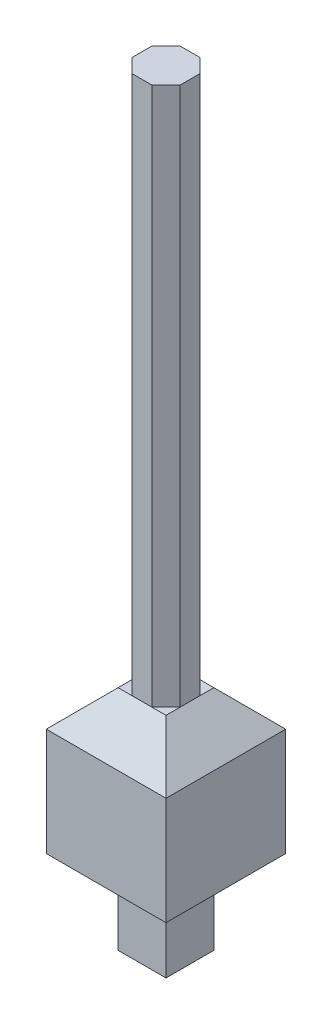
from build123d import *

# Parameters (mm, degrees)
SKETCH5_W            = 10
SKETCH5_H            = 10
BOSS_EXTRUDE6_DEPTH  = 8
CHAMFER10_SIZE       = 3
SKETCH6_W            = 4
SKETCH6_H            = 4
BOSS_EXTRUDE7_DEPTH  = 4
SKETCH7_W            = 10
SKETCH7_H            = 10
BOSS_EXTRUDE9_DEPTH  = 7
CHAMFER13_SIZE       = 3
BOSS_EXTRUDE11_DEPTH = 45


with BuildPart() as part:
    # Sketch5 → Boss-Extrude6 (new body)
    with BuildSketch(Plane(origin=(0, 0, 0), x_dir=(1, 0, 0), z_dir=(0, 1, 0))):
        Rectangle(SKETCH5_W, SKETCH5_H)
    extrude(amount=BOSS_EXTRUDE6_DEPTH)

    # Chamfer10
    chamfer10_edges = [part.edges().sort_by_distance(p)[0] for p in [
        (0, 0, 5),
        (-5, 0, 0),
        (0, 0, -5),
        (5, 0, 0),
    ]]
    chamfer(chamfer10_edges, length=CHAMFER10_SIZE)

    # Sketch6 → Boss-Extrude7 (add)
    with BuildSketch(Plane(origin=(0, 0, 0), x_dir=(1, 0, 0), z_dir=(0, 1, 0))):
        Rectangle(SKETCH6_W, SKETCH6_H)
    extrude(amount=-BOSS_EXTRUDE7_DEPTH)

    # Sketch7 → Boss-Extrude9 (add)
    with BuildSketch(Plane(origin=(0, 8, 0), x_dir=(1, 0, 0), z_dir=(0, 1, 0))):
        Rectangle(SKETCH7_W, SKETCH7_H)
    extrude(amount=BOSS_EXTRUDE9_DEPTH)

    # Chamfer13
    chamfer13_edges = [part.edges().sort_by_distance(p)[0] for p in [
        (-5, 15, 0),
        (0, 15, 5),
        (5, 15, 0),
        (0, 15, -5),
    ]]
    chamfer(chamfer13_edges, length=CHAMFER13_SIZE)

    # Sketch8 → Boss-Extrude11 (add)
    with BuildSketch(Plane(origin=(0, 15, 0), x_dir=(1, 0, 0), z_dir=(0, 1, 0))):
        Polygon((2, 0.828427125), (0.828427125, 2), (-0.828427125, 2), (-2, 0.828427125), (-2, -0.828427125), (-0.828427125, -2), (0.828427125, -2), (2, -0.828427125), align=None)
    extrude(amount=BOSS_EXTRUDE11_DEPTH)


solid = part.part
